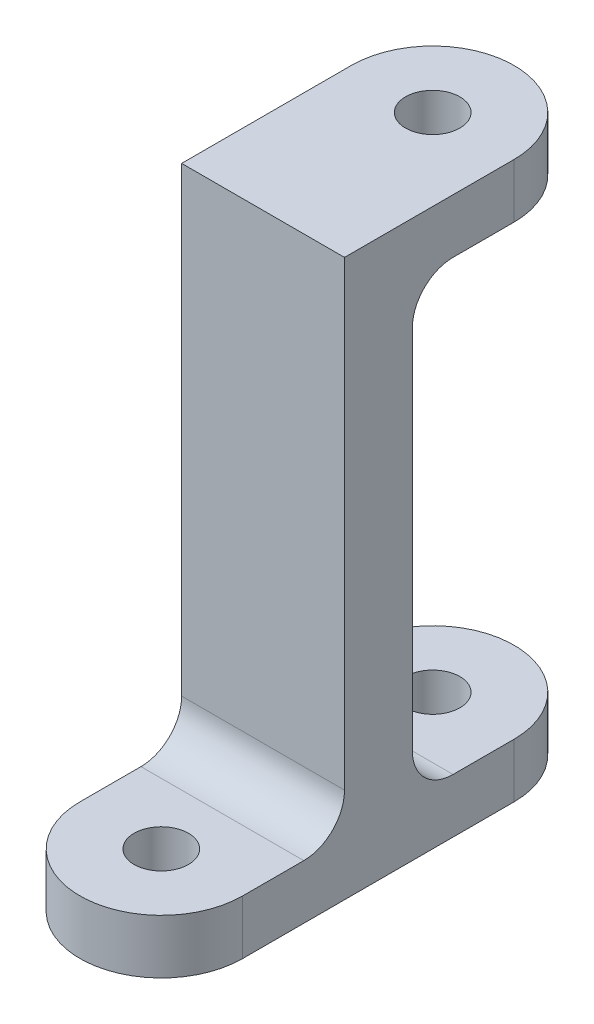
from build123d import *

# Parameters (mm, degrees)
SKETCH1_R           = 2
BOSS_EXTRUDE1_DEPTH = 4
SKETCH2_W           = 12
SKETCH2_H           = 5
BOSS_EXTRUDE2_DEPTH = 33
SKETCH3_R           = 2
SKETCH3_W           = 12
SKETCH3_H           = 5
BOSS_EXTRUDE3_DEPTH = 4
FILLET1_R           = 3


with BuildPart() as part:
    # Sketch1 → Boss-Extrude1 (new body)
    with BuildSketch(Plane(origin=(0, 0, 0), x_dir=(1, 0, 0), z_dir=(0, 1, 0))):
        with BuildLine():
            ThreePointArc((6, 20), (0, 26), (-6, 20))
            Line((-6, 20), (-6, 0))
            ThreePointArc((-6, 0), (0, -6), (6, 0))
            Line((6, 0), (6, 20))
        make_face()
        with Locations(Location((0, 20, 0), (0, 0, 270))):
            Circle(SKETCH1_R, mode=Mode.SUBTRACT)
        with Locations(Location((0, 0, 0), (0, 0, 270))):
            Circle(SKETCH1_R, mode=Mode.SUBTRACT)
    extrude(amount=BOSS_EXTRUDE1_DEPTH)

    # Sketch2 → Boss-Extrude2 (add)
    with BuildSketch(Plane(origin=(0, 4, 0), x_dir=(1, 0, 0), z_dir=(0, 1, 0))):
        with Locations((0, 10)):
            Rectangle(SKETCH2_W, SKETCH2_H)
    extrude(amount=BOSS_EXTRUDE2_DEPTH)

    # Sketch3 → Boss-Extrude3 (add)
    # profile 1 of 2: a face of its own
    with BuildSketch(Plane(origin=(0, 37, 0), x_dir=(1, 0, 0), z_dir=(0, 1, 0))):
        with BuildLine():
            Line((6, 12.5), (6, 20))
            ThreePointArc((6, 20), (0, 26), (-6, 20))
            Line((-6, 20), (-6, 12.5))
            Line((-6, 12.5), (6, 12.5))
        make_face()
        with Locations(Location((0, 20, 0), (0, 0, 270))):
            Circle(SKETCH3_R, mode=Mode.SUBTRACT)
    # profile 2 of 2: a face of its own
    with BuildSketch(Plane(origin=(0, 37, 0), x_dir=(1, 0, 0), z_dir=(0, 1, 0))):
        with Locations((0, 10)):
            Rectangle(SKETCH3_W, SKETCH3_H)
    extrude(amount=BOSS_EXTRUDE3_DEPTH)

    # Fillet1
    fillet1_edges = [part.edges().sort_by_distance(p)[0] for p in [
        (0, 4, -12.5),
        (0, 37, -12.5),
        (0, 4, -7.5),
    ]]
    fillet(fillet1_edges, radius=FILLET1_R)


solid = part.part
